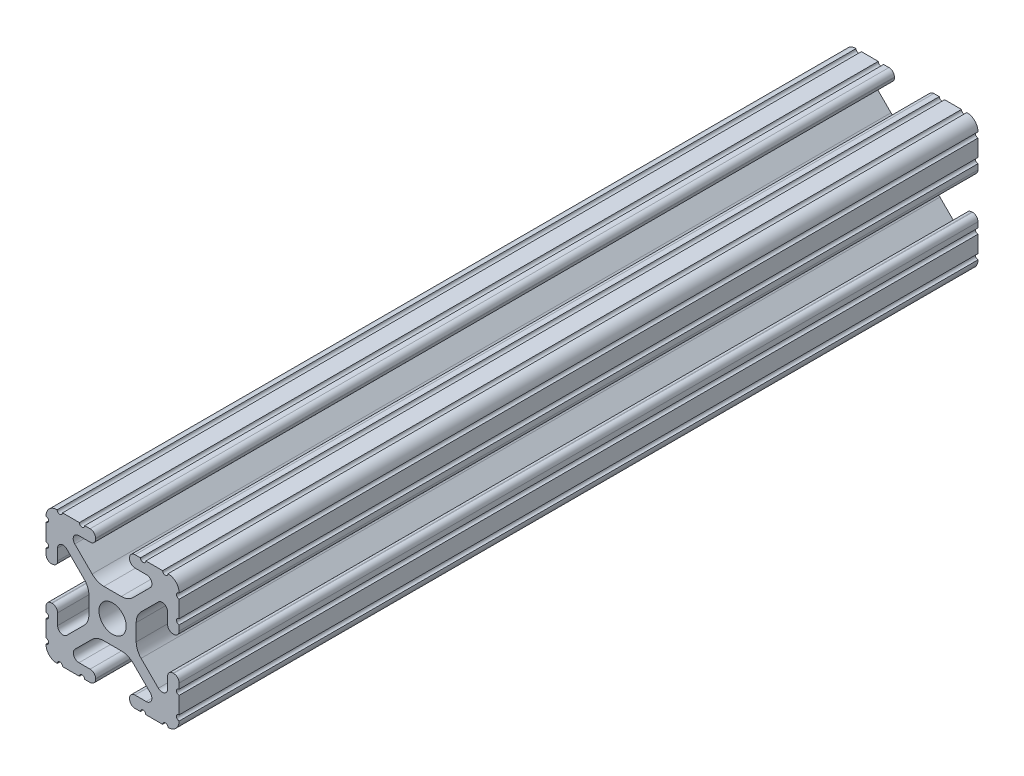
from build123d import *

# Parameters (mm, degrees)
SKETCH1_R               = 2.6035
BOSS_EXTRUDE1_DEPTH     = 152.4
CUT_EXTRUDE1_DEPTH      = 126.238
CUT_EXTRUDE1_DEPTH_BACK = 151.384


with BuildPart() as part:
    # Sketch1 → Boss-Extrude1 (new, symmetric)
    with BuildSketch(Plane.XY):
        with BuildLine():
            Line((-7.179650497, -8.645192506), (-3.952270251, -5.423690499))
            ThreePointArc((-3.952270251, -5.423690499), (-2.922936451, -4.736929036), (-1.709253557, -4.4958))
            Line((-1.709253557, -4.4958), (1.709253557, -4.4958))
            ThreePointArc((1.709253557, -4.4958), (2.922936451, -4.736929036), (3.952270251, -5.423690499))
            Line((3.952270251, -5.423690499), (7.179650497, -8.645192506))
            ThreePointArc((7.179650497, -8.645192506), (7.41473083, -9.822813117), (6.416408329, -10.4902))
            Line((6.416408329, -10.4902), (4.287512407, -10.4902))
            ThreePointArc((4.287512407, -10.4902), (3.54574862, -10.79744862), (3.2385, -11.539212407))
            Line((3.2385, -11.539212407), (3.2385, -11.650987593))
            ThreePointArc((3.2385, -11.650987593), (3.54574862, -12.39275138), (4.287512407, -12.7))
            Line((4.287512407, -12.7), (5.317126718, -12.7))
            ThreePointArc((5.317126718, -12.7), (5.825126718, -12.192), (6.333126718, -12.7))
            Line((6.333126718, -12.7), (9.550443118, -12.7))
            ThreePointArc((9.550443118, -12.7), (10.058366869, -12.192000006), (10.566443095, -12.699847501))
            ThreePointArc((10.566443095, -12.699847501), (12.082537762, -12.08250727), (12.699846982, -10.566399977))
            ThreePointArc((12.699846982, -10.566399977), (12.192000006, -10.058323491), (12.7, -9.5504))
            Line((12.7, -9.5504), (12.7, -6.3330836))
            ThreePointArc((12.7, -6.3330836), (12.192, -5.8250836), (12.7, -5.3170836))
            Line((12.7, -5.3170836), (12.7, -4.287469289))
            ThreePointArc((12.7, -4.287469289), (12.39275138, -3.545705502), (11.650987593, -3.238456882))
            Line((11.650987593, -3.238456882), (11.539212407, -3.238456882))
            ThreePointArc((11.539212407, -3.238456882), (10.79744862, -3.545705502), (10.4902, -4.287469289))
            Line((10.4902, -4.287469289), (10.4902, -6.402089023))
            ThreePointArc((10.4902, -6.402089023), (9.856505071, -7.351067942), (8.737131347, -7.129408934))
            Line((8.737131347, -7.129408934), (5.441005833, -3.840816462))
            ThreePointArc((5.441005833, -3.840816462), (4.750877967, -2.809883091), (4.5085, -1.593185507))
            Line((4.5085, -1.593185507), (4.5085, 1.593185507))
            ThreePointArc((4.5085, 1.593185507), (4.750877967, 2.809883091), (5.441005833, 3.840816462))
            Line((5.441005833, 3.840816462), (8.737131347, 7.129408934))
            ThreePointArc((8.737131347, 7.129408934), (9.856505071, 7.351067942), (10.4902, 6.402089023))
            Line((10.4902, 6.402089023), (10.4902, 4.287469289))
            ThreePointArc((10.4902, 4.287469289), (10.79744862, 3.545705502), (11.539212407, 3.238456882))
            Line((11.539212407, 3.238456882), (11.650987593, 3.238456882))
            ThreePointArc((11.650987593, 3.238456882), (12.39275138, 3.545705502), (12.7, 4.287469289))
            Line((12.7, 4.287469289), (12.7, 5.3170836))
            ThreePointArc((12.7, 5.3170836), (12.192, 5.8250836), (12.7, 6.3330836))
            Line((12.7, 6.3330836), (12.7, 9.5504))
            ThreePointArc((12.7, 9.5504), (12.192000006, 10.058323491), (12.699846982, 10.566399977))
            ThreePointArc((12.699846982, 10.566399977), (12.082537762, 12.08250727), (10.566443095, 12.699847501))
            ThreePointArc((10.566443095, 12.699847501), (10.058366869, 12.192000006), (9.550443118, 12.7))
            Line((9.550443118, 12.7), (6.333126718, 12.7))
            ThreePointArc((6.333126718, 12.7), (5.825126718, 12.192), (5.317126718, 12.7))
            Line((5.317126718, 12.7), (4.287512407, 12.7))
            ThreePointArc((4.287512407, 12.7), (3.54574862, 12.39275138), (3.2385, 11.650987593))
            Line((3.2385, 11.650987593), (3.2385, 11.539212407))
            ThreePointArc((3.2385, 11.539212407), (3.54574862, 10.79744862), (4.287512407, 10.4902))
            Line((4.287512407, 10.4902), (6.476788598, 10.4902))
            ThreePointArc((6.476788598, 10.4902), (7.432222385, 9.85140422), (7.207036008, 8.724370562))
            Line((7.207036008, 8.724370562), (3.898272566, 5.423169045))
            ThreePointArc((3.898272566, 5.423169045), (2.869120213, 4.736787962), (1.655778399, 4.4958))
            Line((1.655778399, 4.4958), (-1.655778399, 4.4958))
            ThreePointArc((-1.655778399, 4.4958), (-2.869120213, 4.736787962), (-3.898272566, 5.423169045))
            Line((-3.898272566, 5.423169045), (-7.207036008, 8.724370562))
            ThreePointArc((-7.207036008, 8.724370562), (-7.432222385, 9.85140422), (-6.476788598, 10.4902))
            Line((-6.476788598, 10.4902), (-4.287512407, 10.4902))
            ThreePointArc((-4.287512407, 10.4902), (-3.54574862, 10.79744862), (-3.2385, 11.539212407))
            Line((-3.2385, 11.539212407), (-3.2385, 11.650987593))
            ThreePointArc((-3.2385, 11.650987593), (-3.54574862, 12.39275138), (-4.287512407, 12.7))
            Line((-4.287512407, 12.7), (-5.317126718, 12.7))
            ThreePointArc((-5.317126718, 12.7), (-5.825126718, 12.192), (-6.333126718, 12.7))
            Line((-6.333126718, 12.7), (-9.550443118, 12.7))
            ThreePointArc((-9.550443118, 12.7), (-10.058366869, 12.192000006), (-10.566443095, 12.699847501))
            ThreePointArc((-10.566443095, 12.699847501), (-12.082537762, 12.08250727), (-12.699846982, 10.566399977))
            ThreePointArc((-12.699846982, 10.566399977), (-12.192000006, 10.058323491), (-12.7, 9.5504))
            Line((-12.7, 9.5504), (-12.7, 6.3330836))
            ThreePointArc((-12.7, 6.3330836), (-12.192, 5.8250836), (-12.7, 5.3170836))
            Line((-12.7, 5.3170836), (-12.7, 4.287469289))
            ThreePointArc((-12.7, 4.287469289), (-12.39275138, 3.545705502), (-11.650987593, 3.238456882))
            Line((-11.650987593, 3.238456882), (-11.539212407, 3.238456882))
            ThreePointArc((-11.539212407, 3.238456882), (-10.79744862, 3.545705502), (-10.4902, 4.287469289))
            Line((-10.4902, 4.287469289), (-10.4902, 6.402089023))
            ThreePointArc((-10.4902, 6.402089023), (-9.856505071, 7.351067942), (-8.737131347, 7.129408934))
            Line((-8.737131347, 7.129408934), (-5.441005833, 3.840816462))
            ThreePointArc((-5.441005833, 3.840816462), (-4.750877967, 2.809883091), (-4.5085, 1.593185507))
            Line((-4.5085, 1.593185507), (-4.5085, -1.593185507))
            ThreePointArc((-4.5085, -1.593185507), (-4.750877967, -2.809883091), (-5.441005833, -3.840816462))
            Line((-5.441005833, -3.840816462), (-8.737131347, -7.129408934))
            ThreePointArc((-8.737131347, -7.129408934), (-9.856505071, -7.351067942), (-10.4902, -6.402089023))
            Line((-10.4902, -6.402089023), (-10.4902, -4.287469289))
            ThreePointArc((-10.4902, -4.287469289), (-10.79744862, -3.545705502), (-11.539212407, -3.238456882))
            Line((-11.539212407, -3.238456882), (-11.650987593, -3.238456882))
            ThreePointArc((-11.650987593, -3.238456882), (-12.39275138, -3.545705502), (-12.7, -4.287469289))
            Line((-12.7, -4.287469289), (-12.7, -5.3170836))
            ThreePointArc((-12.7, -5.3170836), (-12.192, -5.8250836), (-12.7, -6.3330836))
            Line((-12.7, -6.3330836), (-12.7, -9.5504))
            ThreePointArc((-12.7, -9.5504), (-12.192000006, -10.058323491), (-12.699846982, -10.566399977))
            ThreePointArc((-12.699846982, -10.566399977), (-12.082537762, -12.08250727), (-10.566443095, -12.699847501))
            ThreePointArc((-10.566443095, -12.699847501), (-10.058366869, -12.192000006), (-9.550443118, -12.7))
            Line((-9.550443118, -12.7), (-6.333126718, -12.7))
            ThreePointArc((-6.333126718, -12.7), (-5.825126718, -12.192), (-5.317126718, -12.7))
            Line((-5.317126718, -12.7), (-4.287512407, -12.7))
            ThreePointArc((-4.287512407, -12.7), (-3.54574862, -12.39275138), (-3.2385, -11.650987593))
            Line((-3.2385, -11.650987593), (-3.2385, -11.539212407))
            ThreePointArc((-3.2385, -11.539212407), (-3.54574862, -10.79744862), (-4.287512407, -10.4902))
            Line((-4.287512407, -10.4902), (-6.416408329, -10.4902))
            ThreePointArc((-6.416408329, -10.4902), (-7.41473083, -9.822813117), (-7.179650497, -8.645192506))
        make_face()
        with Locations(Location((0, 0, 0), (0, 0, 180))):
            Circle(SKETCH1_R, mode=Mode.SUBTRACT)
    extrude(amount=BOSS_EXTRUDE1_DEPTH, both=True)

    # Sketch2 → Cut-Extrude1 (cut, two sides: drawn at the far end of the back side and taken through both)
    with BuildSketch(Plane(origin=(0, 0, 0), x_dir=(1, 0, 0), z_dir=(0, 1, 0)).offset(-CUT_EXTRUDE1_DEPTH_BACK)):
        Polygon((12.699846982, 152.4), (-59.992081931, 152.4), (-59.992081931, 0), (12.699846982, 0), (35.187530963, 0), (35.187530963, 152.4), align=None)
    extrude(amount=CUT_EXTRUDE1_DEPTH + CUT_EXTRUDE1_DEPTH_BACK, mode=Mode.SUBTRACT)


solid = part.part
